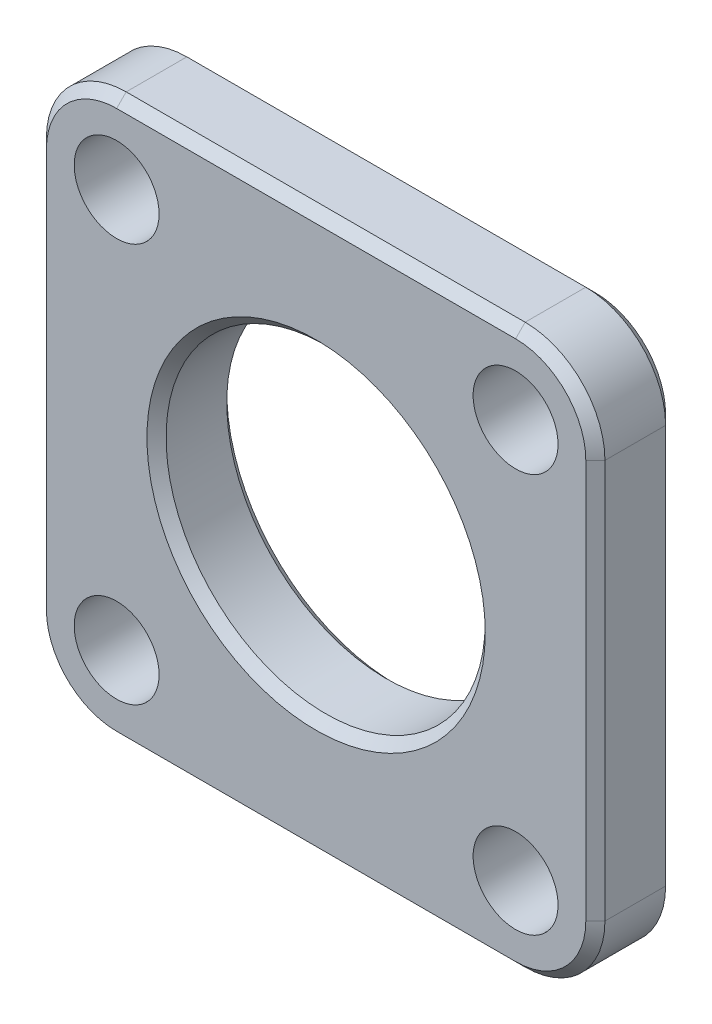
from build123d import *

# Parameters (mm, degrees)
BASE_SKETCH_W           = 44.45
BASE_SKETCH_H           = 44.45
BASE_SKETCH_R           = 12.7
BASE_EXTRUDE_DEPTH      = 6.35
CORNER_FILLET_R         = 6.35
PERIPHERAL_CHAMFER_SIZE = 0.762
CORNER_SKETCH_R         = 3.3782
CORNER_CUT_DEPTH        = 33.065928179


with BuildPart() as part:
    # Base Sketch → Base Extrude (new body)
    with BuildSketch(Plane.XY):
        Rectangle(BASE_SKETCH_W, BASE_SKETCH_H)
        Circle(BASE_SKETCH_R, mode=Mode.SUBTRACT)
    extrude(amount=-BASE_EXTRUDE_DEPTH)

    # Corner Fillet
    corner_fillet_edges = [part.edges().sort_by_distance(p)[0] for p in [
        (-22.225, 22.225, -3.175),
        (22.225, 22.225, -3.175),
        (22.225, -22.225, -3.175),
        (-22.225, -22.225, -3.175),
    ]]
    fillet(corner_fillet_edges, radius=CORNER_FILLET_R)

    # Peripheral Chamfer
    peripheral_chamfer_edges = [part.edges().sort_by_distance(p)[0] for p in [
        (-12.7, 0, -6.35),
        (-12.7, 0, 0),
        (-22.225, 0, 0),
        (-22.225, 0, -6.35),
        (0, -22.225, 0),
        (22.225, 0, 0),
        (0, 22.225, 0),
        (20.365128061, 20.365128061, 0),
        (20.365128061, -20.365128061, 0),
        (-20.365128061, 20.365128061, 0),
        (-20.365128061, -20.365128061, 0),
        (0, -22.225, -6.35),
        (0, 22.225, -6.35),
        (22.225, 0, -6.35),
        (20.365128061, 20.365128061, -6.35),
        (20.365128061, -20.365128061, -6.35),
        (-20.365128061, 20.365128061, -6.35),
        (-20.365128061, -20.365128061, -6.35),
    ]]
    chamfer(peripheral_chamfer_edges, length=PERIPHERAL_CHAMFER_SIZE)

    # Corner Sketch → Corner Cut (cut, through all)
    with BuildSketch(Plane.XY):
        with Locations((15.875, 15.875)):
            Circle(CORNER_SKETCH_R)
        with Locations((15.875, -15.875)):
            Circle(CORNER_SKETCH_R)
        with Locations((-15.875, -15.875)):
            Circle(CORNER_SKETCH_R)
        with Locations((-15.875, 15.875)):
            Circle(CORNER_SKETCH_R)
    extrude(amount=-CORNER_CUT_DEPTH, mode=Mode.SUBTRACT)


solid = part.part
